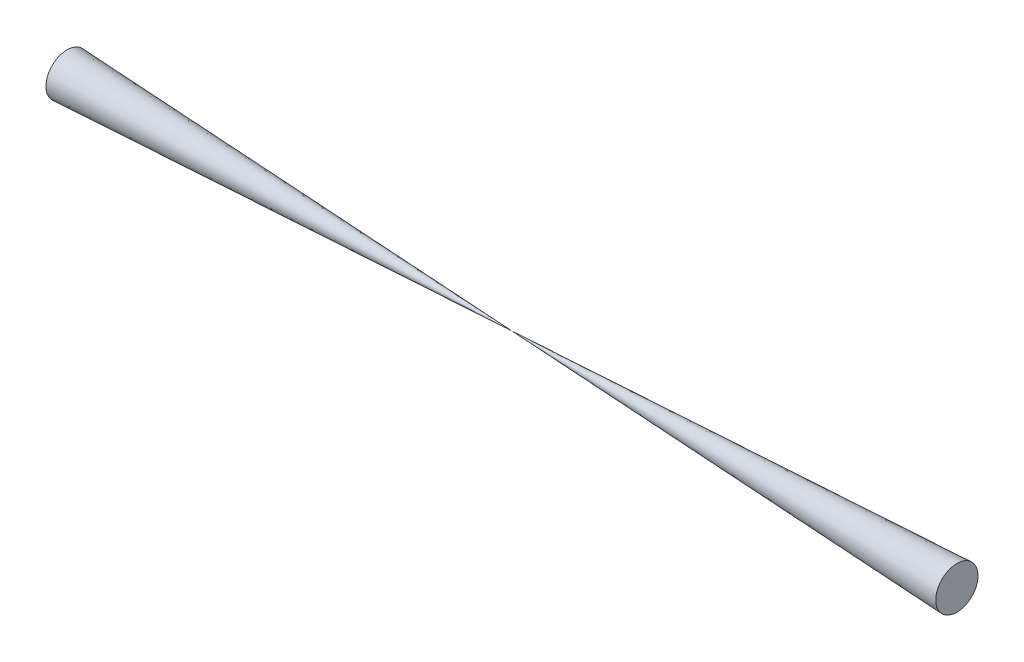
from build123d import *


with BuildPart() as part:
    # 草图1 → 旋转1 (revolve)
    with BuildSketch(Plane(origin=(0, 0, 0), x_dir=(1, 0, 0), z_dir=(0, 1, 0))):
        Polygon((0, 0), (0, 0.005), (200, 9.5), (200, 0), align=None)
    revolve_1 = revolve(axis=Axis((200, 0, 0), (-1, 0, 0)))

    # 镜向1: 旋转1 across plane
    add(revolve_1.mirror(Plane.ZY))


solid = part.part
